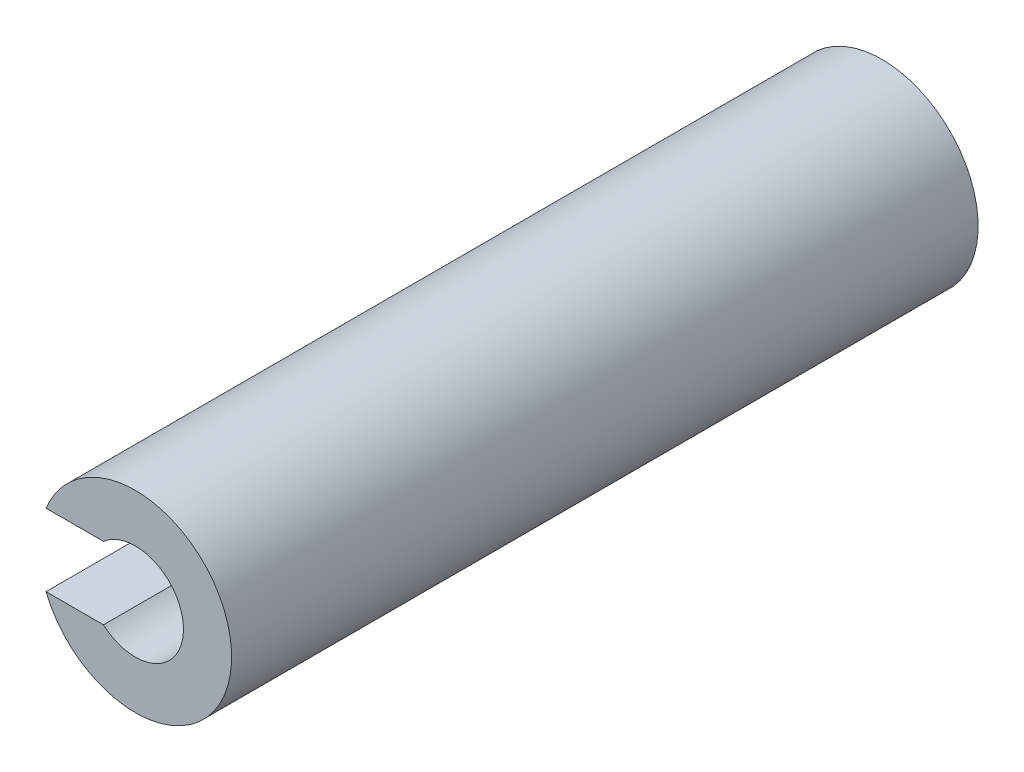
from build123d import *

# Parameters (mm, degrees)
BOSS_EXTRUDE1_DEPTH      = 5
BOSS_EXTRUDE1_DEPTH_BACK = 26


with BuildPart() as part:
    # Sketch1 → Boss-Extrude1 (new, two sides: drawn at the far end of the back side and taken through both)
    with BuildSketch(Plane.XY.offset(-64.896293081).offset(-BOSS_EXTRUDE1_DEPTH_BACK)):
        with BuildLine():
            Line((-3.708099243, -12.144565099), (-1.322875655, -12.144565099))
            ThreePointArc((-1.322875655, -12.144565099), (2, -10.644565099), (-1.322875655, -9.144565099))
            Line((-1.322875655, -9.144565099), (-2, -9.144565099))
            Line((-2, -9.144565099), (-3.708099243, -9.144565099))
            ThreePointArc((-3.708099243, -9.144565099), (4, -10.644565099), (-3.708099243, -12.144565099))
        make_face()
    extrude(amount=BOSS_EXTRUDE1_DEPTH + BOSS_EXTRUDE1_DEPTH_BACK)


solid = part.part
